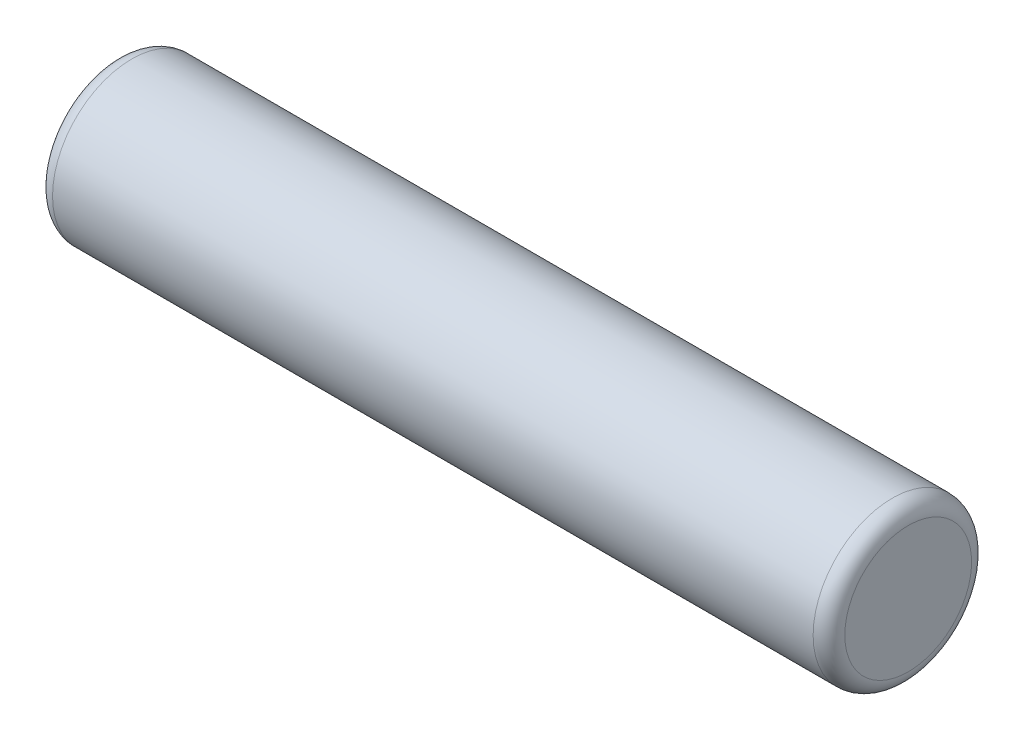
from build123d import *

# Parameters (mm, degrees)
IZIM1_W   = 50
IZIM1_H   = 5
RADYUS1_R = 1


with BuildPart() as part:
    # Çizim1 → Döndür1 (revolve)
    with BuildSketch(Plane.XY, mode=Mode.PRIVATE) as d_nd_r1_sk:
        with Locations((25, 2.5)):
            Rectangle(IZIM1_W, IZIM1_H)
    revolve(d_nd_r1_sk.sketch.rotate(Axis((0, 0, 0), (1, 0, 0)), 90), axis=Axis((0, 0, 0), (1, 0, 0)))

    # Radyus1
    radyus1_edges = [part.edges().sort_by_distance(p)[0] for p in [
        (50, 0, -5),
        (0, 0, -5),
    ]]
    fillet(radyus1_edges, radius=RADYUS1_R)


solid = part.part
